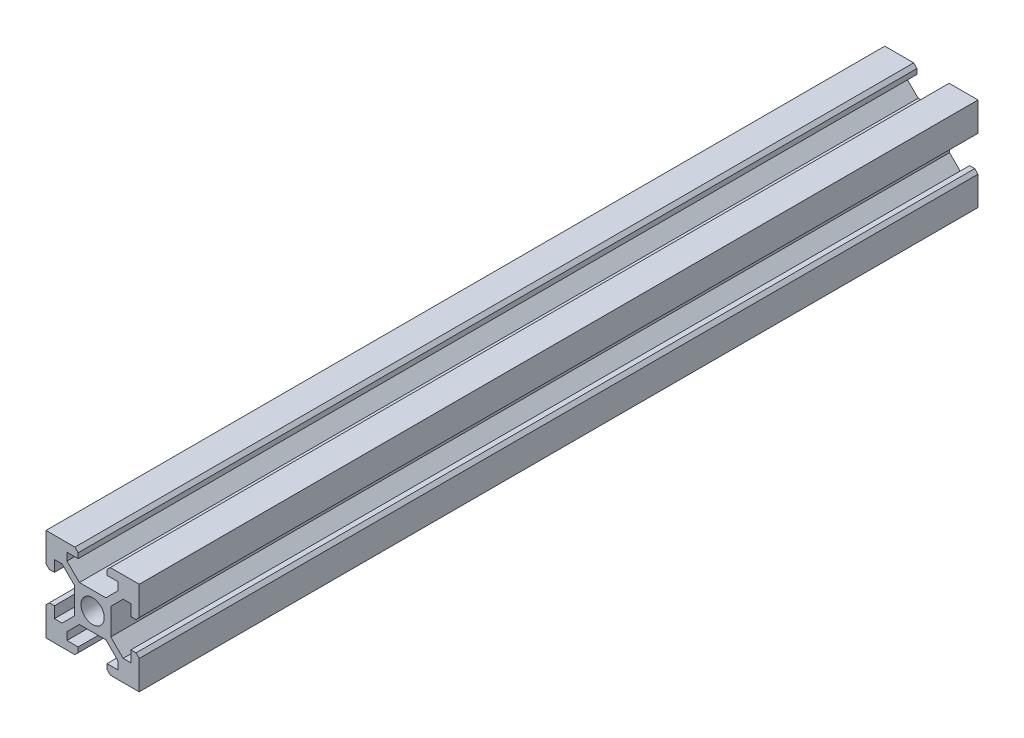
from build123d import *

# Parameters (mm, degrees)
SKETCH1_R           = 2.5
BOSS_EXTRUDE1_DEPTH = 90


with BuildPart() as part:
    # Sketch1 → Boss-Extrude1 (new, symmetric)
    with BuildSketch(Plane.XY):
        Polygon((3.9, -2.839339828), (6.560660172, -5.5), (8.200660172, -5.5), (8.200660172, -3.1), (9.3, -3.1), (10, -3.8), (10, -10), (3.8, -10), (3.1, -9.3), (3.1, -8.200660172), (5.5, -8.200660172), (5.5, -6.560660172), (2.839339828, -3.9), (-2.839339828, -3.9), (-5.5, -6.560660172), (-5.5, -8.200660172), (-3.1, -8.200660172), (-3.1, -9.3), (-3.8, -10), (-10, -10), (-10, -3.8), (-9.3, -3.1), (-8.200660172, -3.1), (-8.200660172, -5.5), (-6.560660172, -5.5), (-3.9, -2.839339828), (-3.9, 2.839339828), (-6.560660172, 5.5), (-8.200660172, 5.5), (-8.200660172, 3.1), (-9.3, 3.1), (-10, 3.8), (-10, 10), (-3.8, 10), (-3.1, 9.3), (-3.1, 8.200660172), (-5.5, 8.200660172), (-5.5, 6.560660172), (-2.839339828, 3.9), (2.839339828, 3.9), (5.5, 6.560660172), (5.5, 8.200660172), (3.1, 8.200660172), (3.1, 9.3), (3.8, 10), (10, 10), (10, 3.8), (9.3, 3.1), (8.200660172, 3.1), (8.200660172, 5.5), (6.560660172, 5.5), (3.9, 2.839339828), align=None)
        with Locations(Location((0, 0, 0), (0, 0, 180))):
            Circle(SKETCH1_R, mode=Mode.SUBTRACT)
    extrude(amount=BOSS_EXTRUDE1_DEPTH, both=True)


solid = part.part
